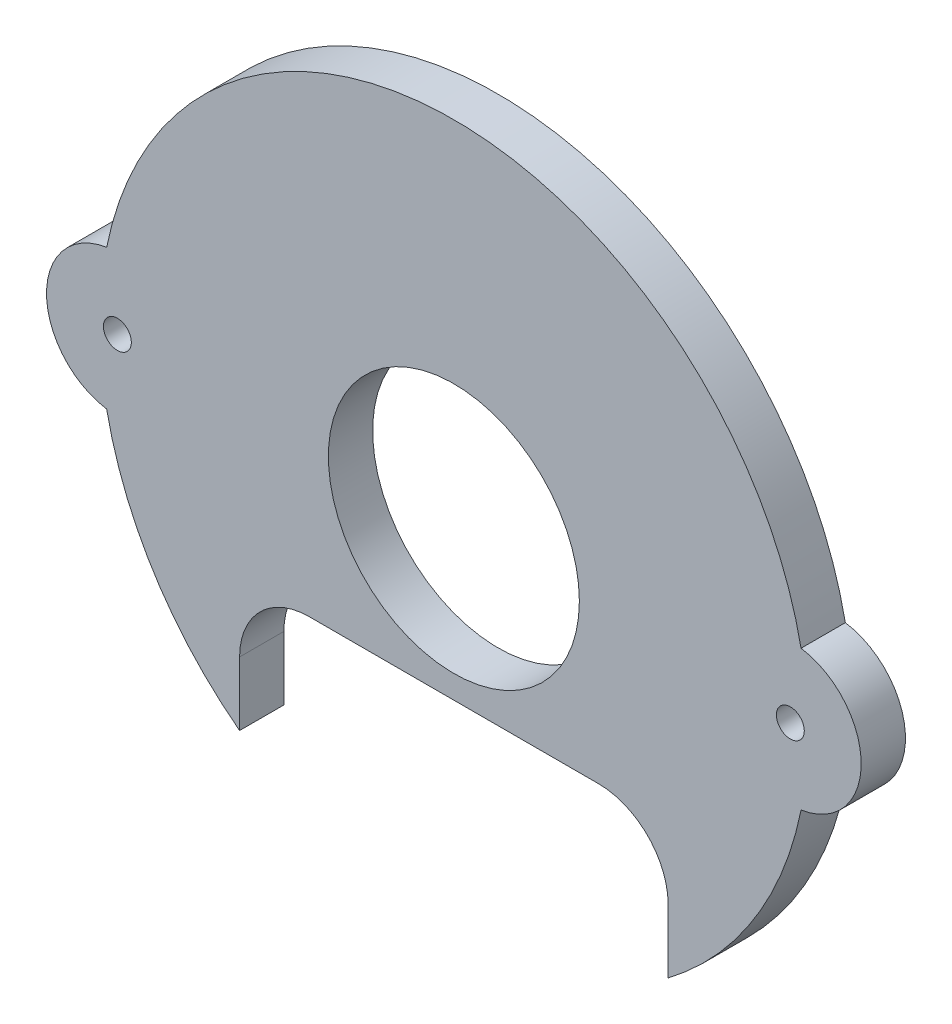
from build123d import *

# Parameters (mm, degrees)
SKETCH1_R           = 1
SKETCH1_R_2         = 9
BOSS_EXTRUDE1_DEPTH = 3.175
CUT_EXTRUDE3_DEPTH  = 9.398
FILLET3_R           = 5


with BuildPart() as part:
    # Sketch1 → Boss-Extrude1 (new body)
    with BuildSketch(Plane.XY):
        with BuildLine():
            ThreePointArc((24.898684211, -5.021506207), (29.21, 0), (24.898684211, 5.021506207))
            ThreePointArc((24.898684211, 5.021506207), (0, 25.4), (-24.898684211, 5.021506207))
            ThreePointArc((-24.898684211, 5.021506207), (-29.21, 0), (-24.898684211, -5.021506207))
            ThreePointArc((-24.898684211, -5.021506207), (0, -25.4), (24.898684211, -5.021506207))
        make_face()
        with Locations((-24.13, 0)):
            Circle(SKETCH1_R, mode=Mode.SUBTRACT)
        with Locations((24.13, 0)):
            Circle(SKETCH1_R, mode=Mode.SUBTRACT)
        Circle(SKETCH1_R_2, mode=Mode.SUBTRACT)
    extrude(amount=BOSS_EXTRUDE1_DEPTH)

    # Sketch2 → Cut-Extrude3 (cut)
    with BuildSketch(Plane.XY):
        with BuildLine():
            Line((-15.367, -20.224126953), (-15.367, -10.654548843))
            Line((-15.367, -10.654548843), (15.367, -10.654548843))
            Line((15.367, -10.654548843), (15.367, -20.224126953))
            ThreePointArc((15.367, -20.224126953), (0, -25.4), (-15.367, -20.224126953))
        make_face()
    extrude(amount=CUT_EXTRUDE3_DEPTH, mode=Mode.SUBTRACT)

    # Fillet3
    fillet3_edges = [part.edges().sort_by_distance(p)[0] for p in [
        (15.367, -10.654548843, 1.5875),
        (-15.367, -10.654548843, 1.5875),
    ]]
    fillet(fillet3_edges, radius=FILLET3_R)


solid = part.part
